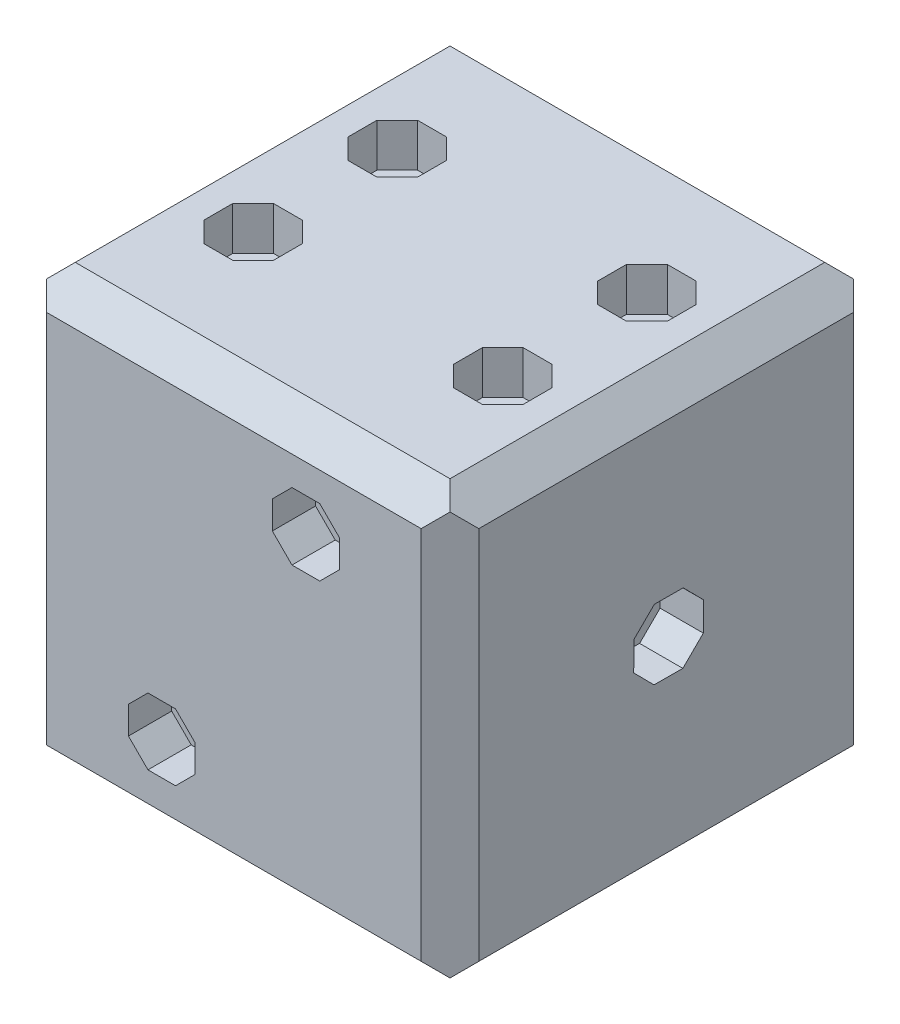
from build123d import *

# Parameters (mm, degrees)
SKETCH1_W           = 15
SKETCH1_H           = 15
BOSS_EXTRUDE1_DEPTH = 15
CUT_EXTRUDE2_DEPTH  = 1.5
CUT_EXTRUDE3_DEPTH  = 1.5
CUT_EXTRUDE4_DEPTH  = 1.5
CUT_EXTRUDE5_DEPTH  = 1.5
CUT_EXTRUDE6_DEPTH  = 1.5
CUT_EXTRUDE7_DEPTH  = 1.5
CUT_EXTRUDE8_DEPTH  = 1.5
CUT_EXTRUDE9_DEPTH  = 1.5
CUT_EXTRUDE10_DEPTH = 1.5
CUT_EXTRUDE11_DEPTH = 1.5
CUT_EXTRUDE12_DEPTH = 1.5
CUT_EXTRUDE13_DEPTH = 1.5
CUT_EXTRUDE14_DEPTH = 1.5
CUT_EXTRUDE15_DEPTH = 1.5
CUT_EXTRUDE16_DEPTH = 1.5
CUT_EXTRUDE17_DEPTH = 1.5
CUT_EXTRUDE18_DEPTH = 1.5
CUT_EXTRUDE19_DEPTH = 1.5
CUT_EXTRUDE20_DEPTH = 1.5
CUT_EXTRUDE21_DEPTH = 1.5
CUT_EXTRUDE22_DEPTH = 1.5
CHAMFER1_SIZE       = 1
CHAMFER2_SIZE       = 1
CHAMFER3_SIZE       = 1
CHAMFER4_SIZE       = 1
CHAMFER5_SIZE       = 1
CHAMFER6_SIZE       = 1
CHAMFER7_SIZE       = 1
CHAMFER8_SIZE       = 1
CHAMFER9_SIZE       = 1
CHAMFER10_SIZE      = 1
CHAMFER11_SIZE      = 1
CHAMFER12_SIZE      = 1


with BuildPart() as part:
    # Sketch1 → Boss-Extrude1 (new body)
    with BuildSketch(Plane(origin=(0, 0, 0), x_dir=(1, 0, 0), z_dir=(0, 1, 0))):
        Rectangle(SKETCH1_W, SKETCH1_H)
    extrude(amount=BOSS_EXTRUDE1_DEPTH)

    # Sketch2 → Cut-Extrude2 (cut)
    with BuildSketch(Plane(origin=(7.5, 0, 0), x_dir=(0, 0, -1), z_dir=(1, 0, 0))):
        Polygon((-0.422768582, 6.268510166), (0.577218895, 6.263505467), (1.287855677, 6.967064536), (1.292860377, 7.967052012), (0.589301308, 8.677688795), (-0.410686168, 8.682693494), (-1.121322951, 7.979134426), (-1.12632765, 6.979146949), align=None)
    extrude(amount=-CUT_EXTRUDE2_DEPTH, mode=Mode.SUBTRACT)

    # Sketch9 → Cut-Extrude3 (cut)
    with BuildSketch(Plane.XY.offset(7.5)):
        Polygon((2.982072982, 10.666299887), (3.663827132, 11.348054037), (3.663827132, 12.312200001), (2.982072982, 12.993954151), (2.017927018, 12.993954151), (1.336172868, 12.312200001), (1.336172868, 11.348054037), (2.017927018, 10.666299887), align=None)
    extrude(amount=-CUT_EXTRUDE3_DEPTH, mode=Mode.SUBTRACT)

    # Sketch10 → Cut-Extrude4 (cut)
    with BuildSketch(Plane.XY.offset(7.5)):
        Polygon((-2.97835429, 4.324722397), (-3.654849416, 3.648227272), (-3.654849416, 2.691518691), (-2.97835429, 2.015023565), (-2.02164571, 2.015023565), (-1.345150584, 2.691518691), (-1.345150584, 3.648227272), (-2.02164571, 4.324722397), align=None)
    extrude(amount=-CUT_EXTRUDE4_DEPTH, mode=Mode.SUBTRACT)

    # Sketch12 → Cut-Extrude5 (cut)
    with BuildSketch(Plane(origin=(0, 0, 0), x_dir=(-1, 0, 0), z_dir=(0, -1, 0))):
        Polygon((-5.5372338, -3), (-4.830127019, -3.707106781), (-3.830127019, -3.707106781), (-3.123020238, -3), (-3.123020238, -2), (-3.830127019, -1.292893219), (-4.830127019, -1.292893219), (-5.5372338, -2), align=None)
    extrude(amount=-CUT_EXTRUDE5_DEPTH, mode=Mode.SUBTRACT)

    # Sketch13 → Cut-Extrude6 (cut)
    with BuildSketch(Plane(origin=(0, 0, 0), x_dir=(-1, 0, 0), z_dir=(0, -1, 0))):
        Polygon((3.830127019, -3.707106781), (4.830127019, -3.707106781), (5.5372338, -3), (5.5372338, -2), (4.830127019, -1.292893219), (3.830127019, -1.292893219), (3.123020238, -2), (3.123020238, -3), align=None)
    extrude(amount=-CUT_EXTRUDE6_DEPTH, mode=Mode.SUBTRACT)

    # Sketch14 → Cut-Extrude7 (cut)
    with BuildSketch(Plane(origin=(0, 0, 0), x_dir=(-1, 0, 0), z_dir=(0, -1, 0))):
        Polygon((0.5, 3.792893219), (1.207106781, 4.5), (1.207106781, 5.5), (0.5, 6.207106781), (-0.5, 6.207106781), (-1.207106781, 5.5), (-1.207106781, 4.5), (-0.5, 3.792893219), align=None)
    extrude(amount=-CUT_EXTRUDE7_DEPTH, mode=Mode.SUBTRACT)

    # Sketch29 → Cut-Extrude8 (cut)
    with BuildSketch(Plane(origin=(0, 0, -7.5), x_dir=(-1, 0, 0), z_dir=(0, 0, -1))):
        Polygon((-2, 10.623020238), (-1.292893219, 11.330127019), (-1.292893219, 12.330127019), (-2, 13.0372338), (-3, 13.0372338), (-3.707106781, 12.330127019), (-3.707106781, 11.330127019), (-3, 10.623020238), align=None)
    extrude(amount=-CUT_EXTRUDE8_DEPTH, mode=Mode.SUBTRACT)

    # Sketch28 → Cut-Extrude9 (cut)
    with BuildSketch(Plane(origin=(0, 0, -7.5), x_dir=(-1, 0, 0), z_dir=(0, 0, -1))):
        Polygon((3.088716776, 10.408838993), (3.921288026, 11.241410243), (3.921288026, 12.418843795), (3.088716776, 13.251415045), (1.911283224, 13.251415045), (1.078711974, 12.418843795), (1.078711974, 11.241410243), (1.911283224, 10.408838993), align=None)
    extrude(amount=-CUT_EXTRUDE9_DEPTH, mode=Mode.SUBTRACT)

    # Sketch27 → Cut-Extrude10 (cut)
    with BuildSketch(Plane(origin=(0, 0, -7.5), x_dir=(-1, 0, 0), z_dir=(0, 0, -1))):
        Polygon((5.5, 6.292893219), (6.207106781, 7), (6.207106781, 8), (5.5, 8.707106781), (4.5, 8.707106781), (3.792893219, 8), (3.792893219, 7), (4.5, 6.292893219), align=None)
    extrude(amount=-CUT_EXTRUDE10_DEPTH, mode=Mode.SUBTRACT)

    # Sketch26 → Cut-Extrude11 (cut)
    with BuildSketch(Plane(origin=(0, 0, -7.5), x_dir=(-1, 0, 0), z_dir=(0, 0, -1))):
        Polygon((3, 1.9627662), (3.707106781, 2.669872981), (3.707106781, 3.669872981), (3, 4.376979762), (2, 4.376979762), (1.292893219, 3.669872981), (1.292893219, 2.669872981), (2, 1.9627662), align=None)
    extrude(amount=-CUT_EXTRUDE11_DEPTH, mode=Mode.SUBTRACT)

    # Sketch25 → Cut-Extrude12 (cut)
    with BuildSketch(Plane(origin=(0, 0, -7.5), x_dir=(-1, 0, 0), z_dir=(0, 0, -1))):
        Polygon((-1.974959137, 1.902312208), (-1.232439227, 2.644832118), (-1.232439227, 3.694913844), (-1.974959137, 4.437433754), (-3.025040863, 4.437433754), (-3.767560773, 3.694913844), (-3.767560773, 2.644832118), (-3.025040863, 1.902312208), align=None)
    extrude(amount=-CUT_EXTRUDE12_DEPTH, mode=Mode.SUBTRACT)

    # Sketch24 → Cut-Extrude13 (cut)
    with BuildSketch(Plane.ZY.offset(7.5)):
        Polygon((-2, 10.623020238), (-1.292893219, 11.330127019), (-1.292893219, 12.330127019), (-2, 13.0372338), (-3, 13.0372338), (-3.707106781, 12.330127019), (-3.707106781, 11.330127019), (-3, 10.623020238), align=None)
    extrude(amount=-CUT_EXTRUDE13_DEPTH, mode=Mode.SUBTRACT)

    # Sketch23 → Cut-Extrude14 (cut)
    with BuildSketch(Plane.ZY.offset(7.5)):
        Polygon((-4.5, 6.292893219), (-3.792893219, 7), (-3.792893219, 8), (-4.5, 8.707106781), (-5.5, 8.707106781), (-6.207106781, 8), (-6.207106781, 7), (-5.5, 6.292893219), align=None)
    extrude(amount=-CUT_EXTRUDE14_DEPTH, mode=Mode.SUBTRACT)

    # Sketch22 → Cut-Extrude15 (cut)
    with BuildSketch(Plane.ZY.offset(7.5)):
        Polygon((-2, 1.9627662), (-1.292893219, 2.669872981), (-1.292893219, 3.669872981), (-2, 4.376979762), (-3, 4.376979762), (-3.707106781, 3.669872981), (-3.707106781, 2.669872981), (-3, 1.9627662), align=None)
    extrude(amount=-CUT_EXTRUDE15_DEPTH, mode=Mode.SUBTRACT)

    # Sketch21 → Cut-Extrude16 (cut)
    with BuildSketch(Plane.ZY.offset(7.5)):
        Polygon((2, 13.0372338), (1.292893219, 12.330127019), (1.292893219, 11.330127019), (2, 10.623020238), (3, 10.623020238), (3.707106781, 11.330127019), (3.707106781, 12.330127019), (3, 13.0372338), align=None)
    extrude(amount=-CUT_EXTRUDE16_DEPTH, mode=Mode.SUBTRACT)

    # Sketch20 → Cut-Extrude17 (cut)
    with BuildSketch(Plane.ZY.offset(7.5)):
        Polygon((5.5, 6.292893219), (6.207106781, 7), (6.207106781, 8), (5.5, 8.707106781), (4.5, 8.707106781), (3.792893219, 8), (3.792893219, 7), (4.5, 6.292893219), align=None)
    extrude(amount=-CUT_EXTRUDE17_DEPTH, mode=Mode.SUBTRACT)

    # Sketch19 → Cut-Extrude18 (cut)
    with BuildSketch(Plane.ZY.offset(7.5)):
        Polygon((3, 4.376979762), (2, 4.376979762), (1.292893219, 3.669872981), (1.292893219, 2.669872981), (2, 1.9627662), (3, 1.9627662), (3.707106781, 2.669872981), (3.707106781, 3.669872981), align=None)
    extrude(amount=-CUT_EXTRUDE18_DEPTH, mode=Mode.SUBTRACT)

    # Sketch18 → Cut-Extrude19 (cut)
    with BuildSketch(Plane(origin=(0, 15, 0), x_dir=(1, 0, 0), z_dir=(0, 1, 0))):
        Polygon((-4.830127019, -1.292893219), (-5.5372338, -2), (-5.5372338, -3), (-4.830127019, -3.707106781), (-3.830127019, -3.707106781), (-3.123020238, -3), (-3.123020238, -2), (-3.830127019, -1.292893219), align=None)
    extrude(amount=-CUT_EXTRUDE19_DEPTH, mode=Mode.SUBTRACT)

    # Sketch17 → Cut-Extrude20 (cut)
    with BuildSketch(Plane(origin=(0, 15, 0), x_dir=(1, 0, 0), z_dir=(0, 1, 0))):
        Polygon((-3.830127019, 1.292893219), (-3.123020238, 2), (-3.123020238, 3), (-3.830127019, 3.707106781), (-4.830127019, 3.707106781), (-5.5372338, 3), (-5.5372338, 2), (-4.830127019, 1.292893219), align=None)
    extrude(amount=-CUT_EXTRUDE20_DEPTH, mode=Mode.SUBTRACT)

    # Sketch16 → Cut-Extrude21 (cut)
    with BuildSketch(Plane(origin=(0, 15, 0), x_dir=(1, 0, 0), z_dir=(0, 1, 0))):
        Polygon((4.830127019, 1.292893219), (5.5372338, 2), (5.5372338, 3), (4.830127019, 3.707106781), (3.830127019, 3.707106781), (3.123020238, 3), (3.123020238, 2), (3.830127019, 1.292893219), align=None)
    extrude(amount=-CUT_EXTRUDE21_DEPTH, mode=Mode.SUBTRACT)

    # Sketch15 → Cut-Extrude22 (cut)
    with BuildSketch(Plane(origin=(0, 15, 0), x_dir=(1, 0, 0), z_dir=(0, 1, 0))):
        Polygon((4.830127019, -3.707106781), (5.5372338, -3), (5.5372338, -2), (4.830127019, -1.292893219), (3.830127019, -1.292893219), (3.123020238, -2), (3.123020238, -3), (3.830127019, -3.707106781), align=None)
    extrude(amount=-CUT_EXTRUDE22_DEPTH, mode=Mode.SUBTRACT)

    # Chamfer1
    chamfer1_edges = [part.edges().sort_by_distance(p)[0] for p in [
        (-7.5, 7.5, 7.5),
    ]]
    chamfer(chamfer1_edges, length=CHAMFER1_SIZE)

    # Chamfer2
    chamfer2_edges = [part.edges().sort_by_distance(p)[0] for p in [
        (-7.5, 0, -0.5),
    ]]
    chamfer(chamfer2_edges, length=CHAMFER2_SIZE)

    # Chamfer3
    chamfer3_edges = [part.edges().sort_by_distance(p)[0] for p in [
        (0.5, 0, 7.5),
    ]]
    chamfer(chamfer3_edges, length=CHAMFER3_SIZE)

    # Chamfer4
    chamfer4_edges = [part.edges().sort_by_distance(p)[0] for p in [
        (0.5, 15, 7.5),
    ]]
    chamfer(chamfer4_edges, length=CHAMFER4_SIZE)

    # Chamfer5
    chamfer5_edges = [part.edges().sort_by_distance(p)[0] for p in [
        (-7.5, 15, -0.5),
    ]]
    chamfer(chamfer5_edges, length=CHAMFER5_SIZE)

    # Chamfer6
    chamfer6_edges = [part.edges().sort_by_distance(p)[0] for p in [
        (-7.5, 7.5, -7.5),
    ]]
    chamfer(chamfer6_edges, length=CHAMFER6_SIZE)

    # Chamfer7
    chamfer7_edges = [part.edges().sort_by_distance(p)[0] for p in [
        (0.5, 15, -7.5),
    ]]
    chamfer(chamfer7_edges, length=CHAMFER7_SIZE)

    # Chamfer8
    chamfer8_edges = [part.edges().sort_by_distance(p)[0] for p in [
        (0.5, 0, -7.5),
    ]]
    chamfer(chamfer8_edges, length=CHAMFER8_SIZE)

    # Chamfer9
    chamfer9_edges = [part.edges().sort_by_distance(p)[0] for p in [
        (7.5, 7.5, 7.5),
    ]]
    chamfer(chamfer9_edges, length=CHAMFER9_SIZE)

    # Chamfer10
    chamfer10_edges = [part.edges().sort_by_distance(p)[0] for p in [
        (7.5, 15, 0),
    ]]
    chamfer(chamfer10_edges, length=CHAMFER10_SIZE)

    # Chamfer11
    chamfer11_edges = [part.edges().sort_by_distance(p)[0] for p in [
        (7.5, 7.5, -7.5),
    ]]
    chamfer(chamfer11_edges, length=CHAMFER11_SIZE)

    # Chamfer12
    chamfer12_edges = [part.edges().sort_by_distance(p)[0] for p in [
        (7.5, 0, 0),
    ]]
    chamfer(chamfer12_edges, length=CHAMFER12_SIZE)


solid = part.part
